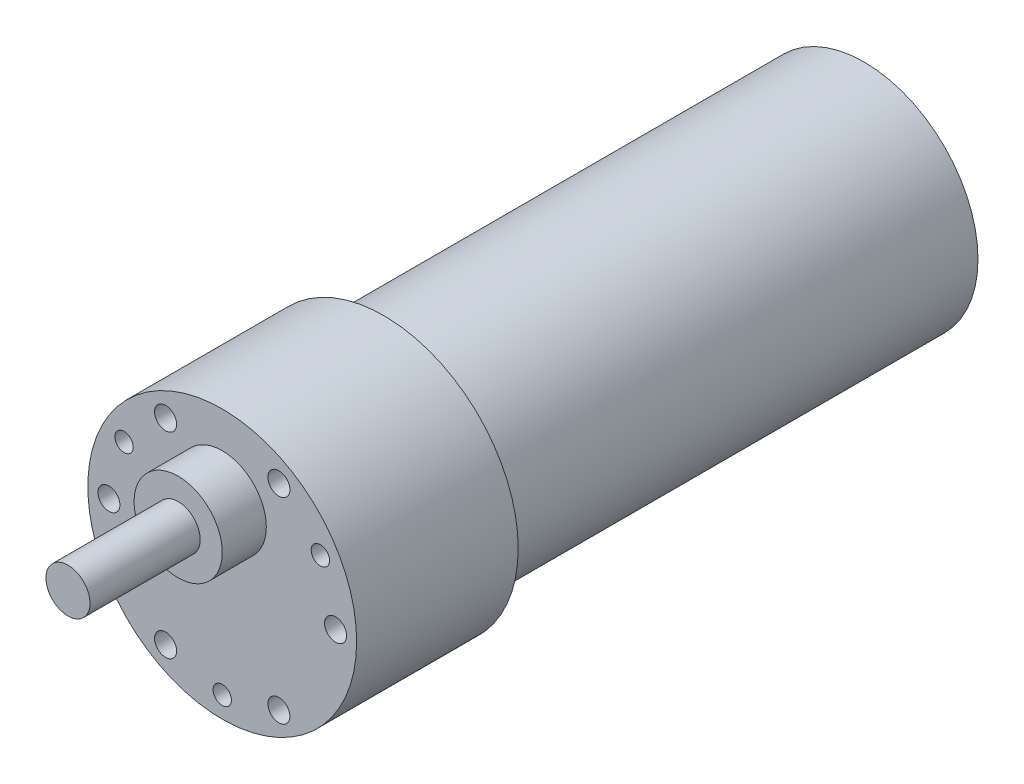
from build123d import *

# Parameters (mm, degrees)
CROQUIS1_R              = 15.5
SALIENTE_EXTRUIR1_DEPTH = 65.4
CROQUIS2_R              = 6
SALIENTE_EXTRUIR2_DEPTH = 2
CROQUIS3_R              = 18.3
SALIENTE_EXTRUIR3_DEPTH = 22
CROQUIS4_R              = 1.5
CORTAR_EXTRUIR1_DEPTH   = 20
CROQUIS5_R              = 1.25
CORTAR_EXTRUIR2_DEPTH   = 20
CROQUIS6_R              = 6
SALIENTE_EXTRUIR4_DEPTH = 6
CROQUIS7_R              = 3
SALIENTE_EXTRUIR5_DEPTH = 15


with BuildPart() as part:
    # Croquis1 → Saliente-Extruir1 (new body)
    with BuildSketch(Plane.XY):
        Circle(CROQUIS1_R)
    extrude(amount=SALIENTE_EXTRUIR1_DEPTH)

    # Croquis2 → Saliente-Extruir2 (add)
    with BuildSketch(Plane(origin=(0, 0, 0), x_dir=(-1, 0, 0), z_dir=(0, 0, -1))):
        Circle(CROQUIS2_R)
    extrude(amount=SALIENTE_EXTRUIR2_DEPTH)

    # Croquis3 → Saliente-Extruir3 (add)
    with BuildSketch(Plane.XY.offset(65.4)):
        Circle(CROQUIS3_R)
    extrude(amount=SALIENTE_EXTRUIR3_DEPTH)

    # Croquis4 → Cortar-Extruir1 (cut)
    with BuildSketch(Plane.XY.offset(87.4)):
        with Locations((-15.43, 0)):
            Circle(CROQUIS4_R)
        with Locations((-7.715, 13.36277198)):
            Circle(CROQUIS4_R)
        with Locations((7.715, 13.36277198)):
            Circle(CROQUIS4_R)
        with Locations((15.43, 0)):
            Circle(CROQUIS4_R)
        with Locations((-7.715, -13.36277198)):
            Circle(CROQUIS4_R)
        with Locations((7.715, -13.36277198)):
            Circle(CROQUIS4_R)
    extrude(amount=-CORTAR_EXTRUIR1_DEPTH, mode=Mode.SUBTRACT)

    # Croquis5 → Cortar-Extruir2 (cut)
    with BuildSketch(Plane.XY.offset(87.4)):
        with Locations((0, -15.43)):
            Circle(CROQUIS5_R)
        with Locations((-13.36277198, 7.715)):
            Circle(CROQUIS5_R)
        with Locations((13.36277198, 7.715)):
            Circle(CROQUIS5_R)
    extrude(amount=-CORTAR_EXTRUIR2_DEPTH, mode=Mode.SUBTRACT)

    # Croquis6 → Saliente-Extruir4 (add)
    with BuildSketch(Plane.XY.offset(87.4)):
        with Locations((0, 7.37)):
            Circle(CROQUIS6_R)
    extrude(amount=SALIENTE_EXTRUIR4_DEPTH)

    # Croquis7 → Saliente-Extruir5 (add)
    with BuildSketch(Plane.XY.offset(93.4)):
        with Locations((0, 7.37)):
            Circle(CROQUIS7_R)
    extrude(amount=SALIENTE_EXTRUIR5_DEPTH)


solid = part.part
